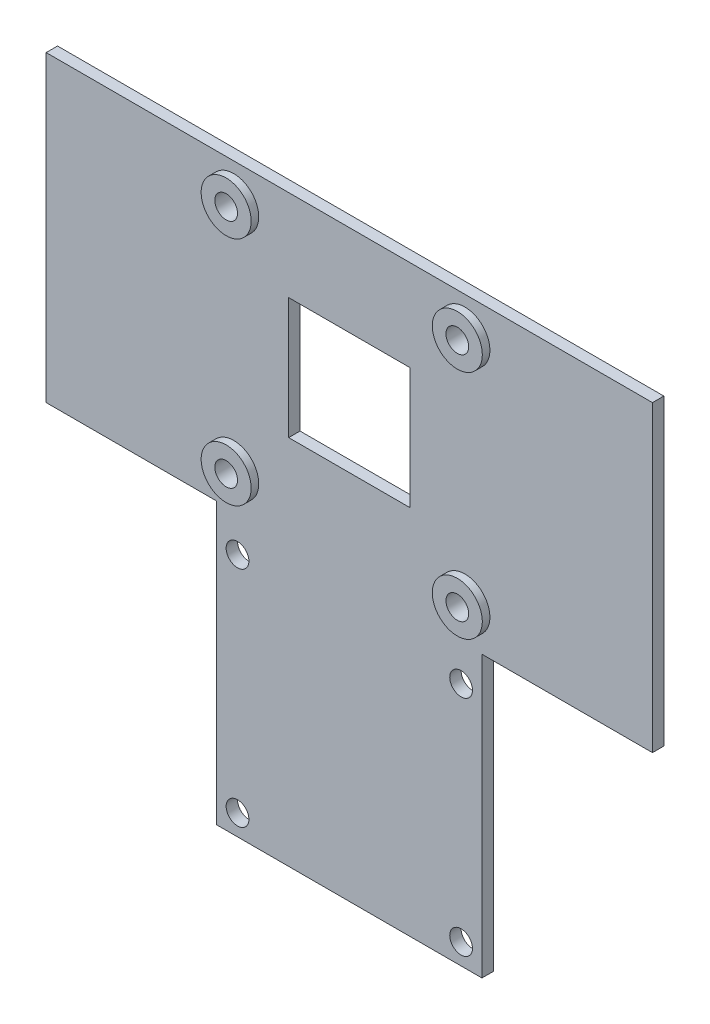
from build123d import *

# Parameters (mm, degrees)
SKETCH_2_R      = 1.5
EXTRUDE_1_DEPTH = 1.5
SKETCH_3_R      = 3.3
SKETCH_3_R_2    = 1.5
EXTRUDE_2_DEPTH = 1


with BuildPart() as part:
    # 草图2 → 凸台-拉伸1 (new body)
    with BuildSketch(Plane.XY):
        Polygon((-47.229146383, 20.256789608), (32.770853617, 20.256789608), (32.770853617, -19.743210392), (10.270853617, -19.743210392), (10.270853617, -56.743210392), (-24.729146383, -56.743210392), (-24.729146383, -19.743210392), (-47.229146383, -19.743210392), align=None)
        with Locations((-22.479146383, 15.506789608)):
            Circle(SKETCH_2_R, mode=Mode.SUBTRACT)
        with Locations(Location((8.020853617, 15.506789608, 0), (0, 0, 180))):
            Circle(SKETCH_2_R, mode=Mode.SUBTRACT)
        with Locations((8.020853617, -14.993210392)):
            Circle(SKETCH_2_R, mode=Mode.SUBTRACT)
        with Locations(Location((-22.479146383, -14.993210392, 0), (0, 0, 180))):
            Circle(SKETCH_2_R, mode=Mode.SUBTRACT)
        with Locations(Location((-21.979146383, -24.493210392, 0), (0, 0, 180))):
            Circle(SKETCH_2_R, mode=Mode.SUBTRACT)
        with Locations(Location((7.520853617, -24.493210392, 0), (0, 0, 180))):
            Circle(SKETCH_2_R, mode=Mode.SUBTRACT)
        with Locations(Location((-21.979146383, -53.993210392, 0), (0, 0, 180))):
            Circle(SKETCH_2_R, mode=Mode.SUBTRACT)
        with Locations(Location((7.520853617, -53.993210392, 0), (0, 0, 180))):
            Circle(SKETCH_2_R, mode=Mode.SUBTRACT)
        Polygon((-7.229146383, -7.743210392), (0.770853617, -7.743210392), (0.770853617, 8.256789608), (-15.229146383, 8.256789608), (-15.229146383, -7.743210392), align=None, mode=Mode.SUBTRACT)
    extrude(amount=EXTRUDE_1_DEPTH)

    # 草图3 → 凸台-拉伸2 (add)
    # profile 1 of 4: a face of its own
    with BuildSketch(Plane.XY.offset(1.5)):
        with Locations((-22.479146383, 15.506789608)):
            Circle(SKETCH_3_R)
        with Locations((-22.479146383, 15.506789608)):
            Circle(SKETCH_3_R_2, mode=Mode.SUBTRACT)
    # profile 2 of 4: a face of its own
    with BuildSketch(Plane.XY.offset(1.5)):
        with Locations((8.020853617, 15.506789608)):
            Circle(SKETCH_3_R)
        with Locations(Location((8.020853617, 15.506789608, 0), (0, 0, 180))):
            Circle(SKETCH_3_R_2, mode=Mode.SUBTRACT)
    # profile 3 of 4: a face of its own
    with BuildSketch(Plane.XY.offset(1.5)):
        with Locations((-22.479146383, -14.993210392)):
            Circle(SKETCH_3_R)
        with Locations(Location((-22.479146383, -14.993210392, 0), (0, 0, 180))):
            Circle(SKETCH_3_R_2, mode=Mode.SUBTRACT)
    # profile 4 of 4: a face of its own
    with BuildSketch(Plane.XY.offset(1.5)):
        with Locations((8.020853617, -14.993210392)):
            Circle(SKETCH_3_R)
        with Locations((8.020853617, -14.993210392)):
            Circle(SKETCH_3_R_2, mode=Mode.SUBTRACT)
    extrude(amount=EXTRUDE_2_DEPTH)


solid = part.part
